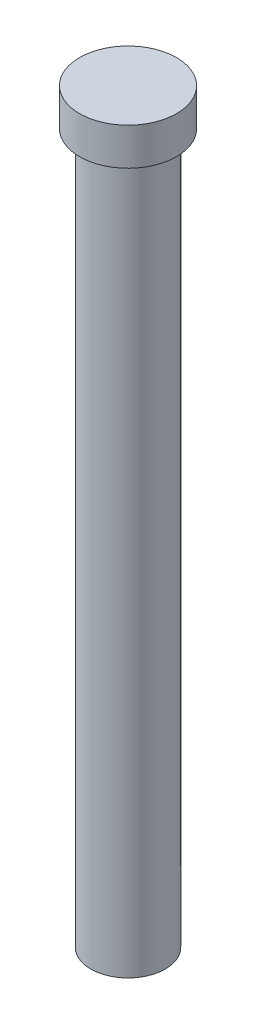
from build123d import *


with BuildPart() as part:
    # Sketch1 → Revolve1 (revolve)
    with BuildSketch(Plane.XY, mode=Mode.PRIVATE) as revolve1_sk:
        Polygon((0, 0), (6.5, 0), (6.5, -5), (5, -5), (5, -100), (0, -100), align=None)
    revolve(revolve1_sk.sketch.rotate(Axis((0, -105, 0), (0, 1, 0)), 90), axis=Axis((0, -105, 0), (0, 1, 0)))


solid = part.part
